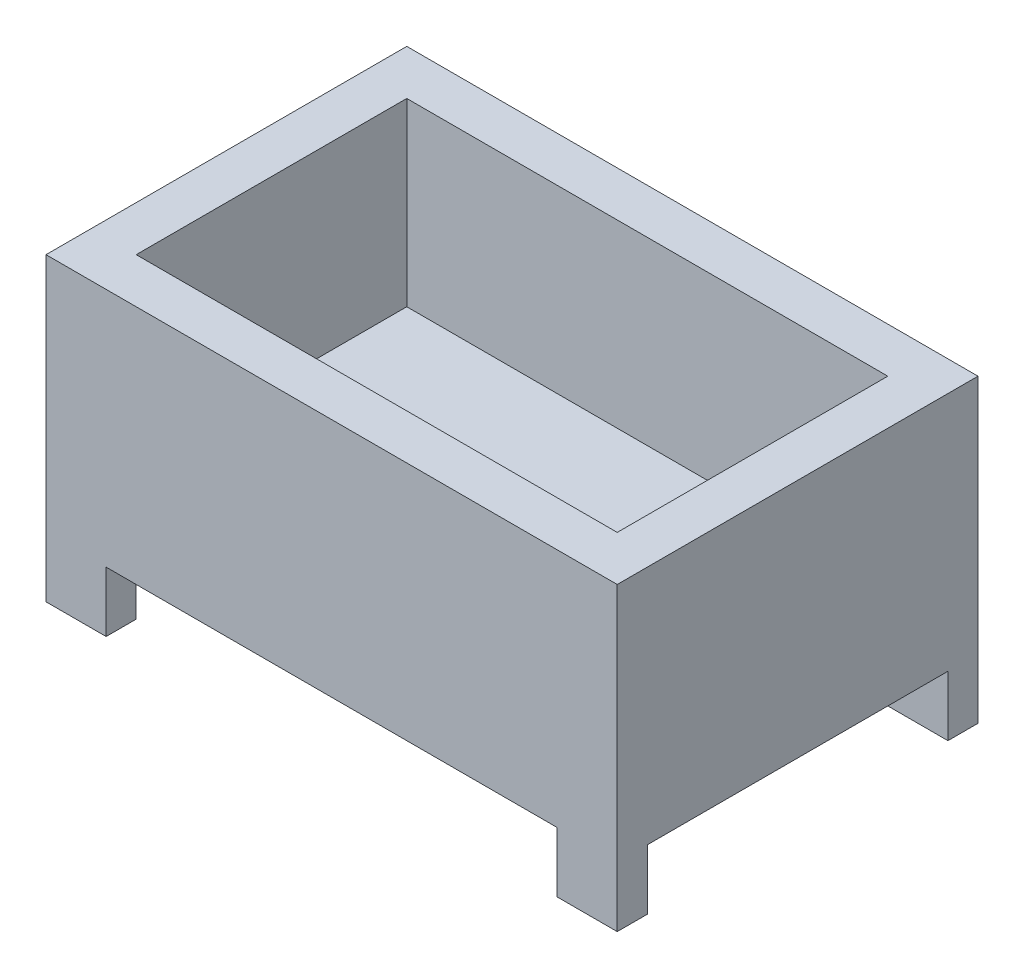
from build123d import *

# Parameters (mm, degrees)
ESQUISSE1_W             = 38
ESQUISSE1_H             = 24
BOSS_EXTRU_1_DEPTH      = 20
ESQUISSE2_W             = 32
ESQUISSE2_H             = 18
ENL_V_MAT_EXTRU_1_DEPTH = 12
ESQUISSE3_W             = 30
ESQUISSE3_H             = 5
ENL_V_MAT_EXTRU_2_DEPTH = 30
ESQUISSE4_W             = 20
ESQUISSE4_H             = 5
ENL_V_MAT_EXTRU_3_DEPTH = 60
ESQUISSE5_R             = 2.5
ENL_V_MAT_EXTRU_4_DEPTH = 60


with BuildPart() as part:
    # Esquisse1 → Boss.-Extru.1 (new body)
    with BuildSketch(Plane(origin=(0, 0, 0), x_dir=(1, 0, 0), z_dir=(0, 1, 0))):
        Rectangle(ESQUISSE1_W, ESQUISSE1_H)
    extrude(amount=BOSS_EXTRU_1_DEPTH)

    # Esquisse2 → Enlèv. mat.-Extru.1 (cut)
    with BuildSketch(Plane(origin=(0, 20, 0), x_dir=(1, 0, 0), z_dir=(0, 1, 0))):
        Rectangle(ESQUISSE2_W, ESQUISSE2_H)
    extrude(amount=-ENL_V_MAT_EXTRU_1_DEPTH, mode=Mode.SUBTRACT)

    # Esquisse3 → Enlèv. mat.-Extru.2 (cut)
    with BuildSketch(Plane.XY.offset(12)):
        with Locations((0, 1.5)):
            Rectangle(ESQUISSE3_W, ESQUISSE3_H)
    extrude(amount=-ENL_V_MAT_EXTRU_2_DEPTH, mode=Mode.SUBTRACT)

    # Esquisse4 → Enlèv. mat.-Extru.3 (cut)
    with BuildSketch(Plane.ZY.offset(19)):
        with Locations((0, 1.5)):
            Rectangle(ESQUISSE4_W, ESQUISSE4_H)
    extrude(amount=-ENL_V_MAT_EXTRU_3_DEPTH, mode=Mode.SUBTRACT)

    # Esquisse5 → Enlèv. mat.-Extru.4 (cut)
    with BuildSketch(Plane(origin=(0, 8, 0), x_dir=(1, 0, 0), z_dir=(0, 1, 0))):
        with Locations(Location((0, 0, 0), (0, 0, 270))):
            Circle(ESQUISSE5_R)
    extrude(amount=-ENL_V_MAT_EXTRU_4_DEPTH, mode=Mode.SUBTRACT)


solid = part.part
